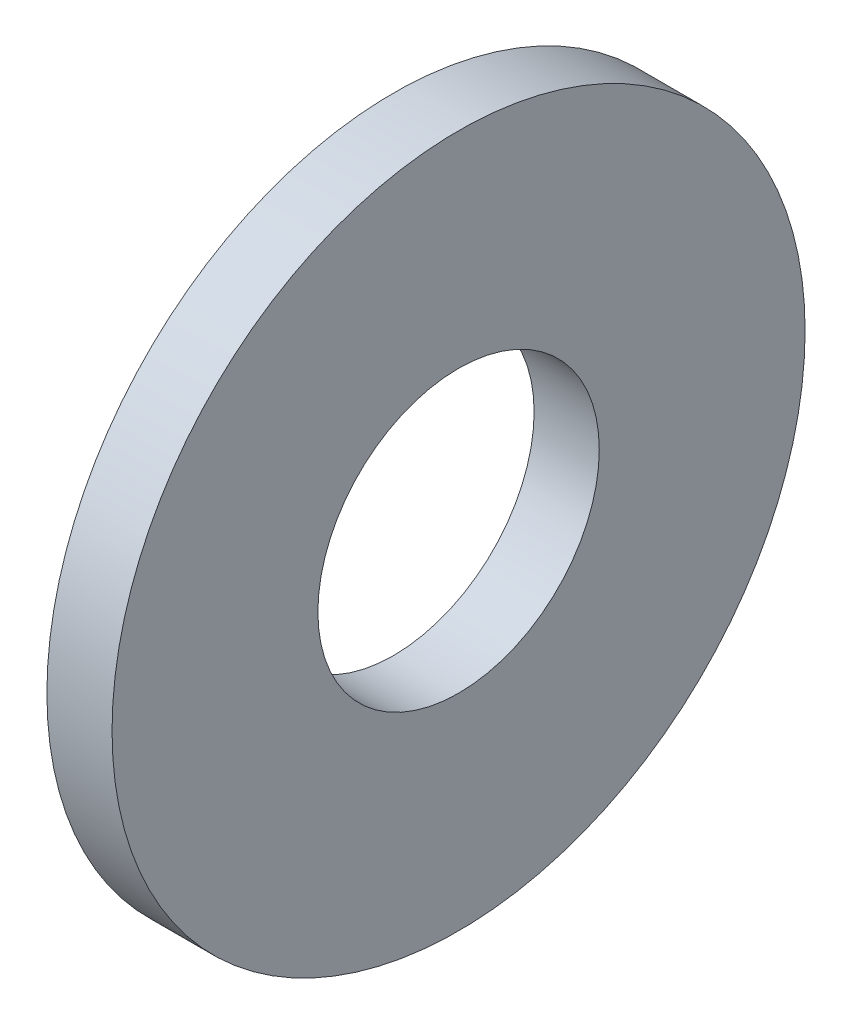
from build123d import *

# Parameters (mm, degrees)
SKETCH1_R           = 6.35
SKETCH1_R_2         = 2.5781
BOSS_EXTRUDE1_DEPTH = 1.1938


with BuildPart() as part:
    # Sketch1 → Boss-Extrude1 (new body)
    with BuildSketch(Plane(origin=(0, 0, 0), x_dir=(0, 0, -1), z_dir=(1, 0, 0))):
        Circle(SKETCH1_R)
        Circle(SKETCH1_R_2, mode=Mode.SUBTRACT)
    extrude(amount=BOSS_EXTRUDE1_DEPTH)


solid = part.part
